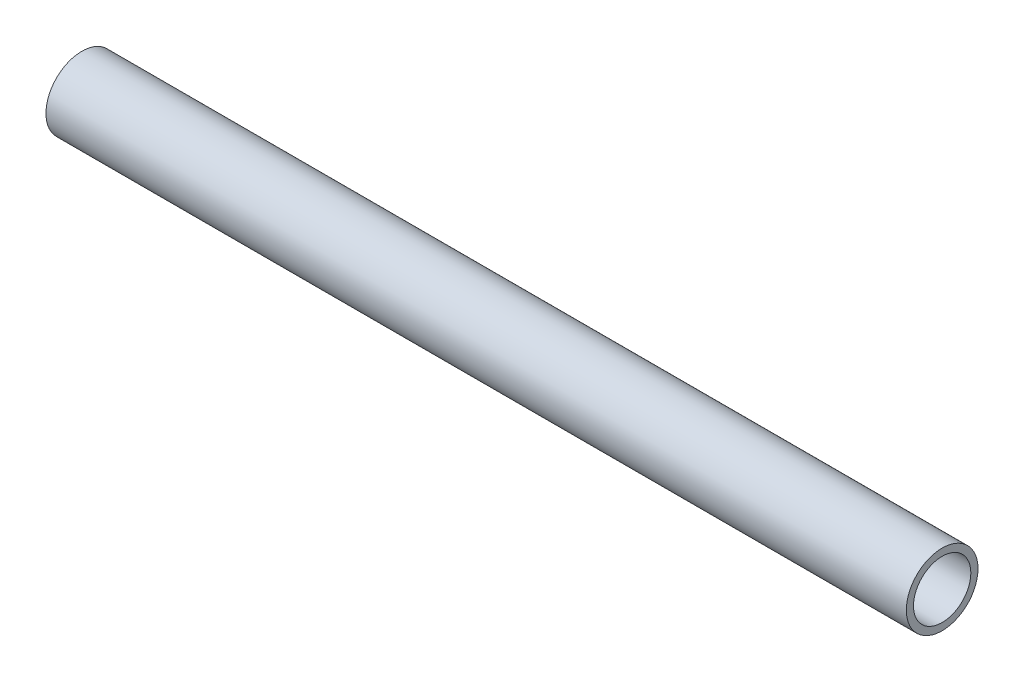
from build123d import *

# Parameters (mm, degrees)
SWEEP_THIN1_PROFILE_R   = 5
SWEEP_THIN1_PROFILE_R_2 = 4


with BuildPart() as part:
    # Sweep-Thin1: sweep along a path in Sketch1
    with BuildLine(Plane.XY) as sweep_thin1_path:
        Line((0, 0), (120, 0))
    # Sweep-Thin1 profile (on start of the path) → Sweep-Thin1 (sweep)
    with BuildSketch(Plane(origin=(0, 0, 0), x_dir=(0, 0, 1), z_dir=(1, 0, 0))):
        Circle(SWEEP_THIN1_PROFILE_R)
        Circle(SWEEP_THIN1_PROFILE_R_2, mode=Mode.SUBTRACT)
    sweep(path=sweep_thin1_path.line)


solid = part.part
